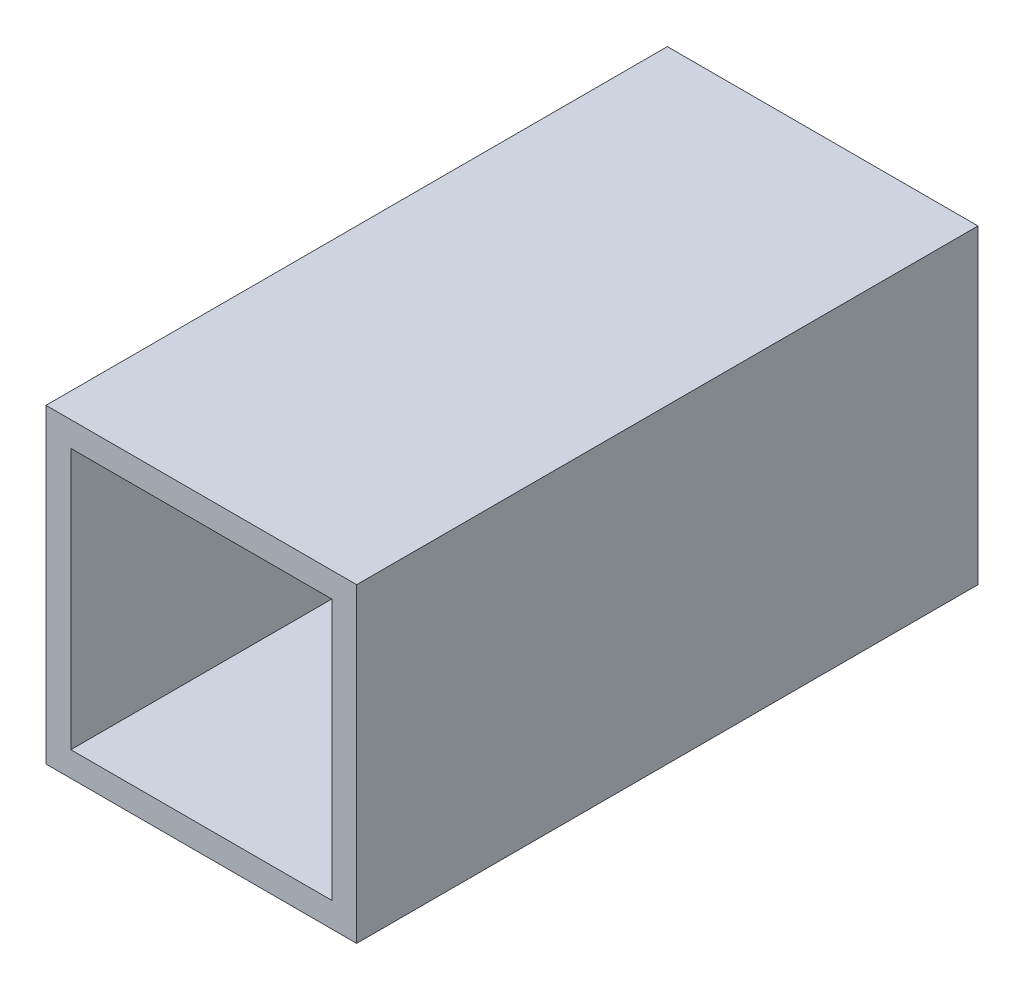
from build123d import *

# Parameters (mm, degrees)
SKETCH1_W           = 25.4
SKETCH1_H           = 25.4
BOSS_EXTRUDE1_DEPTH = 50.8
SKETCH2_W           = 21.336
SKETCH2_H           = 21.336
CUT_EXTRUDE1_DEPTH  = 96.850716413


with BuildPart() as part:
    # Sketch1 → Boss-Extrude1 (new body)
    with BuildSketch(Plane.XY):
        with Locations((-54.818987342, -32.553797468)):
            Rectangle(SKETCH1_W, SKETCH1_H)
    extrude(amount=BOSS_EXTRUDE1_DEPTH)

    # Sketch2 → Cut-Extrude1 (cut, through all)
    with BuildSketch(Plane.XY.offset(50.8)):
        with Locations((-54.818987342, -32.553797468)):
            Rectangle(SKETCH2_W, SKETCH2_H)
    extrude(amount=-CUT_EXTRUDE1_DEPTH, mode=Mode.SUBTRACT)


solid = part.part
